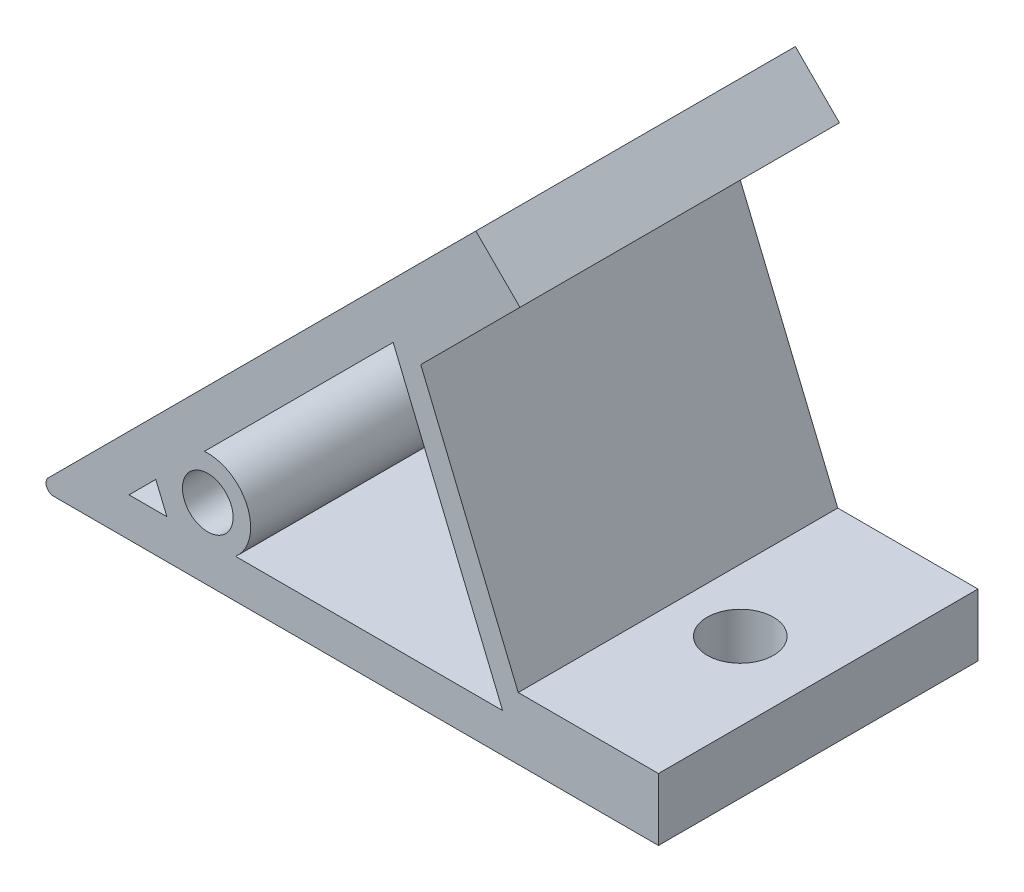
from build123d import *

# Parameters (mm, degrees)
SKETCH_1_R          = 3.25
EXTRUDE_1_DEPTH     = 20.5
SKETCH_3_R          = 4.25
CUT_EXTRUDE_1_DEPTH = 17


with BuildPart() as part:
    # 草图1 → 凸台-拉伸1 (new, symmetric)
    with BuildSketch(Plane.XY):
        with BuildLine():
            Line((-77.585786438, 0), (0, 0))
            Line((0, 0), (0, 8))
            Line((0, 8), (-17.995464086, 8))
            Line((-17.995464086, 8), (-30.499317942, 38.186973559))
            Line((-30.499317942, 38.186973559), (-17.774603256, 50.911688245))
            Line((-17.774603256, 50.911688245), (-23.431457505, 56.568542495))
            Line((-23.431457505, 56.568542495), (-78.292893219, 1.707106781))
            ThreePointArc((-78.292893219, 1.707106781), (-78.50966597, 0.617316568), (-77.585786438, 0))
        make_face()
        with Locations((-57.82689122, 9.184402377)):
            Circle(SKETCH_1_R, mode=Mode.SUBTRACT)
        Polygon((-67.928932188, 5), (-63.07447047, 5), (-64.496309389, 8.4326228), align=None, mode=Mode.SUBTRACT)
        with BuildLine():
            Line((-54.257468753, 5), (-20, 5))
            Line((-20, 5), (-34.038059223, 38.890872965))
            Line((-34.038059223, 38.890872965), (-58.261747684, 14.667184504))
            ThreePointArc((-58.261747684, 14.667184504), (-52.745553791, 11.289161255), (-54.257468753, 5))
        make_face(mode=Mode.SUBTRACT)
    extrude(amount=EXTRUDE_1_DEPTH, both=True)

    # 草图3 → 切除-拉伸1 (cut)
    with BuildSketch(Plane(origin=(0, 8, 0), x_dir=(1, 0, 0), z_dir=(0, 1, 0))):
        with Locations(Location((-10, 0, 0), (0, 0, 180))):
            Circle(SKETCH_3_R)
    cut_extrude_1 = extrude(amount=-CUT_EXTRUDE_1_DEPTH, mode=Mode.SUBTRACT)

    # 镜向1: 切除-拉伸1 across plane
    add(cut_extrude_1.mirror(Plane(origin=(-11.715728753, 28.284271247, 0), x_dir=(0, 0, 1), z_dir=(-0.3826834323650881, 0.9238795325112875, 0))), mode=Mode.SUBTRACT)


solid = part.part
